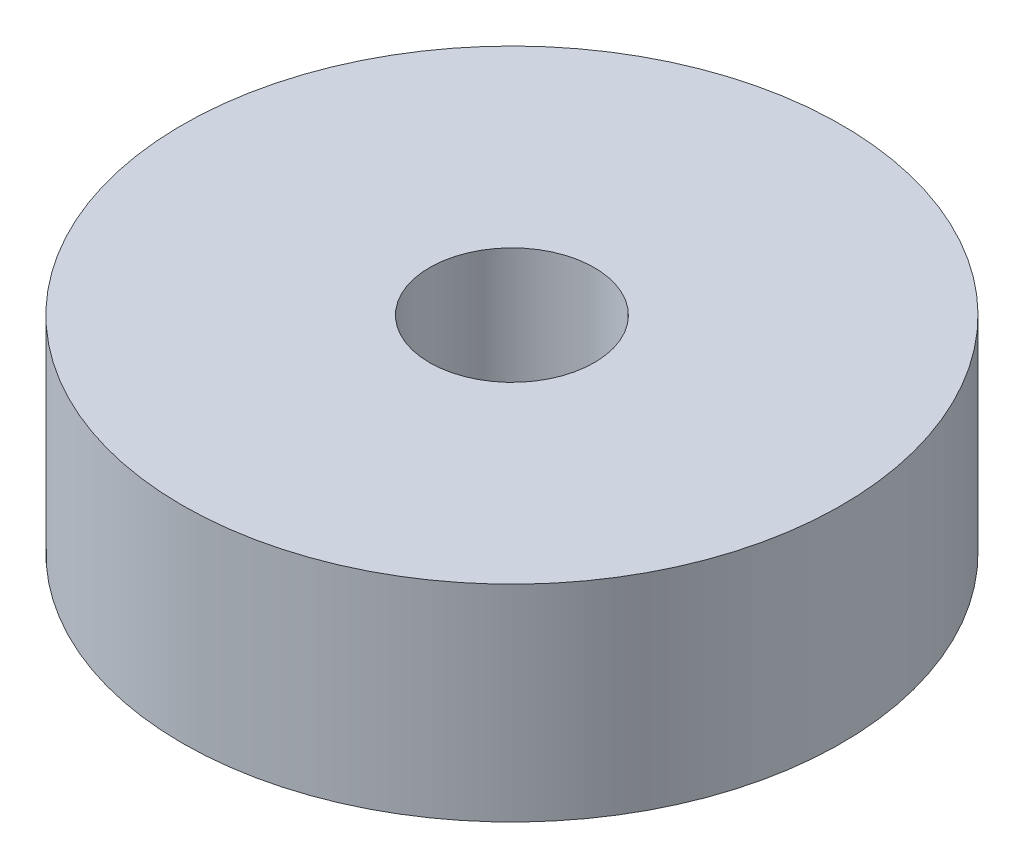
from build123d import *

# Parameters (mm, degrees)
SKETCH_1_R      = 8
SKETCH_1_R_2    = 2
EXTRUDE_1_DEPTH = 5


with BuildPart() as part:
    # 草图1 → 凸台-拉伸1 (new body)
    with BuildSketch(Plane(origin=(0, 0, 0), x_dir=(1, 0, 0), z_dir=(0, 1, 0))):
        with Locations(Location((0, 0, 0), (0, 0, 270))):
            Circle(SKETCH_1_R)
        with Locations(Location((0, 0, 0), (0, 0, 270))):
            Circle(SKETCH_1_R_2, mode=Mode.SUBTRACT)
    extrude(amount=EXTRUDE_1_DEPTH)


solid = part.part
